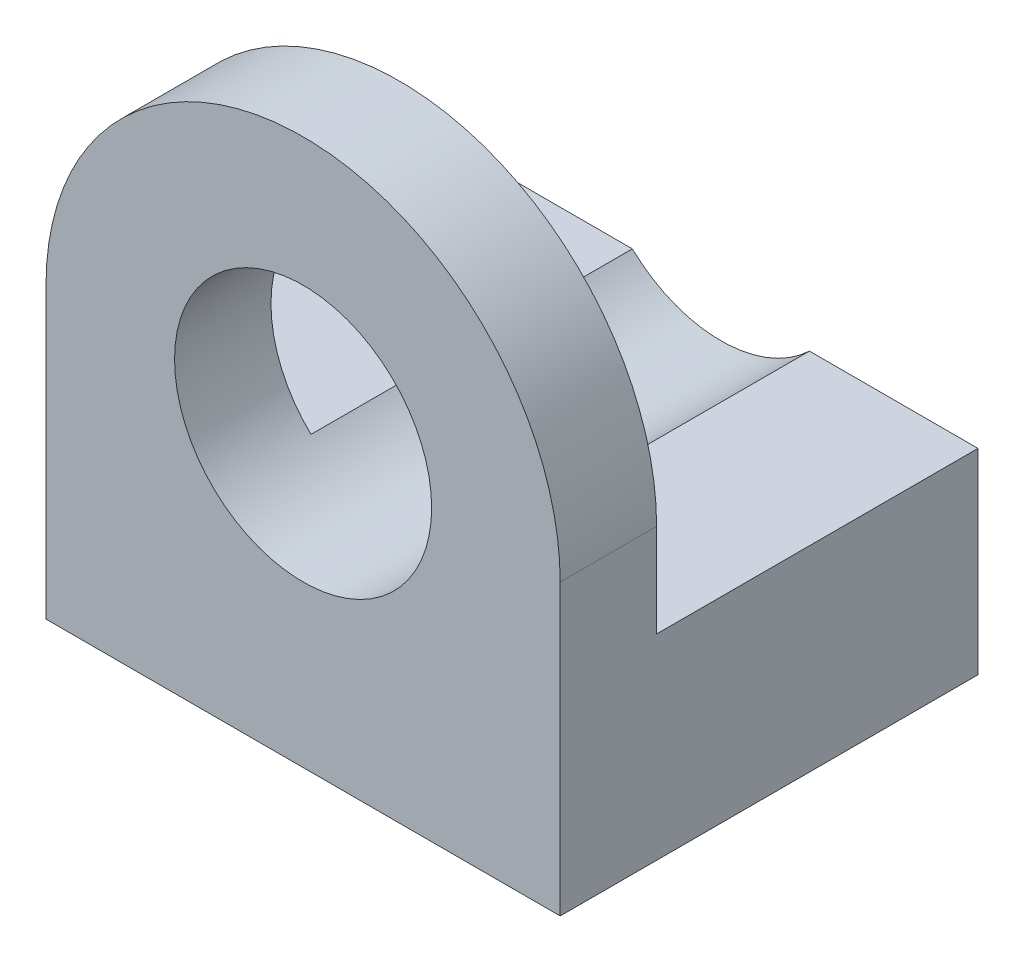
from build123d import *

# Parameters (mm, degrees)
SKETCH1_R           = 40
SKETCH1_R_2         = 20
BOSS_EXTRUDE1_DEPTH = 15
BOSS_EXTRUDE2_START = 50
BOSS_EXTRUDE2_DEPTH = 50


with BuildPart() as part:
    # Sketch1 → Boss-Extrude1 (new body)
    # profile 1 of 2: a face of its own
    with BuildSketch(Plane.XY):
        Circle(SKETCH1_R)
        Circle(SKETCH1_R_2, mode=Mode.SUBTRACT)
    # profile 2 of 2: a face of its own
    with BuildSketch(Plane.XY):
        with BuildLine():
            ThreePointArc((40, 0), (0, -40), (-40, 0))
            Line((-40, 0), (-40, -45))
            Line((-40, -45), (40, -45))
            Line((40, -45), (40, 0))
        make_face()
    extrude(amount=BOSS_EXTRUDE1_DEPTH)

    # Sketch3 → Boss-Extrude2 (add)
    with BuildSketch(Plane(origin=(0, 0, 0), x_dir=(-1, 0, 0), z_dir=(0, 0, -1)).offset(BOSS_EXTRUDE2_START)):
        with BuildLine():
            Line((13.774977314, -14.5), (40, -14.5))
            Line((40, -14.5), (40, -45))
            Line((40, -45), (-40, -45))
            Line((-40, -45), (-40, -14.5))
            Line((-40, -14.5), (-13.774977314, -14.5))
            ThreePointArc((-13.774977314, -14.5), (0, -20), (13.774977314, -14.5))
        make_face()
    extrude(amount=-BOSS_EXTRUDE2_DEPTH)


solid = part.part
